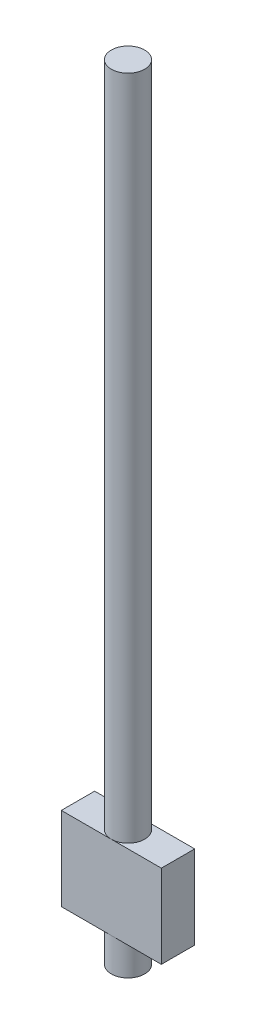
from build123d import *

# Parameters (mm, degrees)
SKETCH1_W           = 3
SKETCH1_H           = 1
BOSS_EXTRUDE1_DEPTH = 2.5
SKETCH2_R           = 0.5
BOSS_EXTRUDE2_DEPTH = 20
BOSS_EXTRUDE3_START = 1
SKETCH3_R           = 0.5
BOSS_EXTRUDE3_DEPTH = 1


with BuildPart() as part:
    # Sketch1 → Boss-Extrude1 (new body)
    with BuildSketch(Plane(origin=(0, 0, 0), x_dir=(1, 0, 0), z_dir=(0, 1, 0))):
        Rectangle(SKETCH1_W, SKETCH1_H)
    extrude(amount=BOSS_EXTRUDE1_DEPTH)

    # Sketch2 → Boss-Extrude2 (add)
    with BuildSketch(Plane(origin=(0, 2.5, 0), x_dir=(1, 0, 0), z_dir=(0, 1, 0))):
        with Locations(Location((0, 0, 0), (0, 0, 270))):
            Circle(SKETCH2_R)
    extrude(amount=BOSS_EXTRUDE2_DEPTH)

    # Sketch3 → Boss-Extrude3 (add)
    with BuildSketch(Plane.XZ.offset(BOSS_EXTRUDE3_START)):
        with Locations(Location((0, 0, 0), (0, 0, 90))):
            Circle(SKETCH3_R)
    extrude(amount=-BOSS_EXTRUDE3_DEPTH)


solid = part.part
